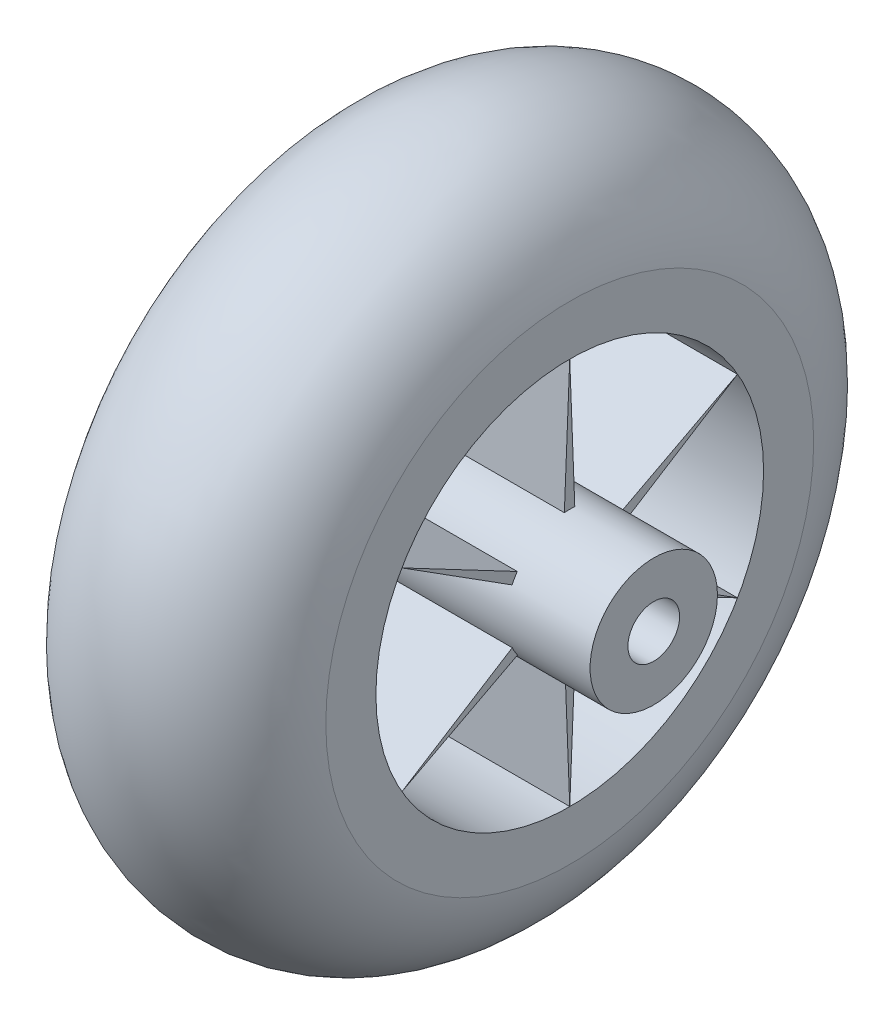
from build123d import *

# Parameters (mm, degrees)
BOSS_EXTRUDE1_DEPTH      = 9.1
BOSS_EXTRUDE1_DEPTH_BACK = 26.6
SKETCH13_R               = 6.9
SKETCH14_R               = 2.8
CUT_EXTRUDE1_DEPTH       = 9.1
BOSS_EXTRUDE2_DEPTH      = 26.6
CIRPATTERN1_COUNT        = 6


with BuildPart() as part:
    # Sketch1 → Revolve10 (revolve)
    with BuildSketch(Plane.XY, mode=Mode.PRIVATE) as revolve10_sk:
        with BuildLine():
            Line((0, 0), (26.6, 0))
            Line((26.6, 0), (26.6, 5.425523727))
            ThreePointArc((26.6, 5.425523727), (13.3, 16.826691133), (0, 5.425523727))
            Line((0, 5.425523727), (0, 0))
        make_face()
    revolve(revolve10_sk.sketch.rotate(Axis((-4.739866393, -21, 0), (1, 0, 0)), 90), axis=Axis((-4.739866393, -21, 0), (1, 0, 0)))


with BuildPart() as body_2:
    # Sketch13 → Boss-Extrude1 (new, two sides: drawn at the far end of the back side and taken through both)
    with BuildSketch(Plane(origin=(26.6, 0, 0), x_dir=(0, 0, -1), z_dir=(1, 0, 0)).offset(-BOSS_EXTRUDE1_DEPTH_BACK)):
        with Locations((0, -21)):
            Circle(SKETCH13_R)
    extrude(amount=BOSS_EXTRUDE1_DEPTH + BOSS_EXTRUDE1_DEPTH_BACK)

    # Sketch14 → Cut-Extrude1 (cut)
    with BuildSketch(Plane(origin=(35.7, 0, 0), x_dir=(0, 0, -1), z_dir=(1, 0, 0))):
        with Locations((0, -21)):
            Circle(SKETCH14_R)
    extrude(amount=-CUT_EXTRUDE1_DEPTH, mode=Mode.SUBTRACT)

    # Sketch16 → Boss-Extrude2 (add)
    with BuildSketch(Plane(origin=(26.6, 0, 0), x_dir=(0, 0, -1), z_dir=(1, 0, 0))):
        with BuildLine():
            Line((0, 0), (-0.585969551, -14.158107951))
            ThreePointArc((-0.585969551, -14.158107951), (-0.019243844, -14.133749454), (0.547481863, -14.158107951))
            Line((0.547481863, -14.158107951), (0, 0))
        make_face()
    boss_extrude2 = extrude(amount=-BOSS_EXTRUDE2_DEPTH)

    # CirPattern1: Boss-Extrude2 ×6 about axis
    cirpattern1_axis = Axis((0, -21, 0), (1, 0, 0))
    for i in range(1, CIRPATTERN1_COUNT):
        add(boss_extrude2.rotate(cirpattern1_axis, i * 360 / CIRPATTERN1_COUNT))


solid = Compound([part.part, body_2.part])
